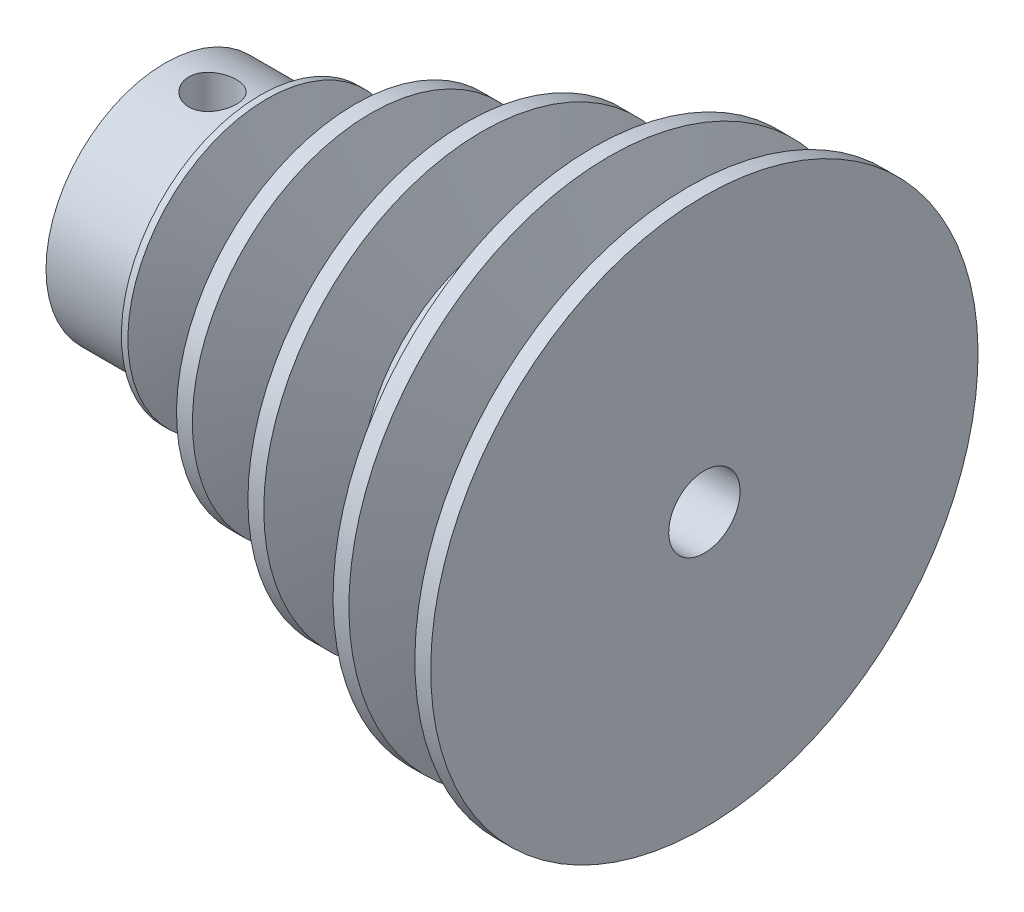
from build123d import *

# Parameters (mm, degrees)
SKETCH3_R          = 3
CUT_EXTRUDE1_DEPTH = 24


with BuildPart() as part:
    # Sketch2 → Revolve1 (revolve)
    with BuildSketch(Plane.XY):
        Polygon((0, 5.73931272), (68, 5.73931272), (68, 35.73931272), (66, 35.73931272), (62.360297657, 25.73931272), (58.993760511, 25.73931272), (55.975766288, 34.031183701), (53.975766288, 34.031183701), (53.975766288, 26.307716676), (51.619965111, 26.307716676), (49.229261585, 19.73931272), (43.229261585, 19.73931272), (39.953529476, 28.73931272), (37.953529476, 28.73931272), (37.953529476, 19.662434754), (34.588066023, 19.662434754), (32.432225909, 13.73931272), (29.593231819, 13.73931272), (25.953529476, 23.73931272), (23.953529476, 23.73931272), (23.953529476, 21.23931272), (22.901415474, 21.23931272), (18.897742897, 10.23931272), (15.914444309, 10.23931272), (12.820697317, 18.73931272), (12, 18.73931272), (12, 16.23931272), (0, 16.23931272), align=None)
    revolve(axis=Axis((0, 1.23931272, 0), (-1, 0, 0)))

    # Sketch3 → Cut-Extrude1 (cut)
    with BuildSketch(Plane(origin=(0, 0, 0), x_dir=(1, 0, 0), z_dir=(0, 1, 0))):
        with Locations(Location((6, 0, 0), (0, 0, 180))):
            Circle(SKETCH3_R)
    extrude(amount=CUT_EXTRUDE1_DEPTH, mode=Mode.SUBTRACT)


solid = part.part
